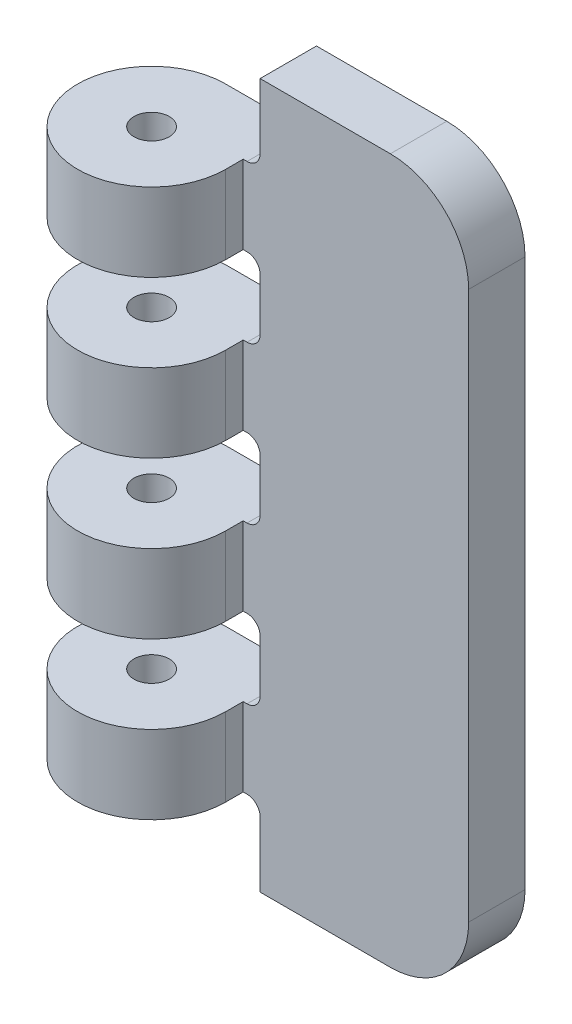
from build123d import *

# Parameters (mm, degrees)
BOSS_EXTRUDE1_START = 31.75
SKETCH3_R           = 1.5875
BOSS_EXTRUDE1_DEPTH = 63.5
FILLET1_R           = 7.055555556
SKETCH5_W           = 16.383
SKETCH5_H           = 7.055555556
CUT_EXTRUDE1_DEPTH  = 43.200038063
LPATTERN1_COUNT     = 5
LPATTERN1_PITCH     = 14.111111111
FILLET2_R           = 1.175925926


with BuildPart() as part:
    # Sketch3 → Boss-Extrude1 (new body)
    with BuildSketch(Plane(origin=(0, 0, 0), x_dir=(1, 0, 0), z_dir=(0, 1, 0)).offset(BOSS_EXTRUDE1_START)):
        with BuildLine():
            Line((26.9875, 6.6675), (26.9875, 1.5875))
            Line((26.9875, 1.5875), (6.6675, 1.5875))
            Line((6.6675, 1.5875), (6.6675, 0))
            ThreePointArc((6.6675, 0), (-4.714634464, -4.714634464), (0, 6.6675))
            Line((0, 6.6675), (26.9875, 6.6675))
        make_face()
        with Locations(Location((0, 0, 0), (0, 0, 270))):
            Circle(SKETCH3_R, mode=Mode.SUBTRACT)
    extrude(amount=-BOSS_EXTRUDE1_DEPTH)

    # Fillet1
    fillet1_edges = [part.edges().sort_by_distance(p)[0] for p in [
        (26.9875, -31.75, -4.1275),
        (26.9875, 31.75, -4.1275),
    ]]
    fillet(fillet1_edges, radius=FILLET1_R)

    # Sketch5 → Cut-Extrude1 (cut, symmetric)
    with BuildSketch(Plane.XY):
        with Locations((0, 28.222222222)):
            Rectangle(SKETCH5_W, SKETCH5_H)
    cut_extrude1 = extrude(amount=CUT_EXTRUDE1_DEPTH, both=True, mode=Mode.SUBTRACT)

    # LPattern1: Cut-Extrude1 ×5
    with Locations(*[(0, -i * LPATTERN1_PITCH, 0) for i in range(1, LPATTERN1_COUNT)]):
        add(cut_extrude1, mode=Mode.SUBTRACT)

    # Fillet2
    fillet2_edges = [part.edges().sort_by_distance(p)[0] for p in [
        (8.1915, -3.527777778, -4.1275),
        (8.1915, 3.527777778, -4.1275),
        (8.1915, -17.638888889, -4.1275),
        (8.1915, -10.583333333, -4.1275),
        (8.1915, -24.694444444, -4.1275),
        (8.1915, 24.694444444, -4.1275),
        (8.1915, 10.583333333, -4.1275),
        (8.1915, 17.638888889, -4.1275),
    ]]
    fillet(fillet2_edges, radius=FILLET2_R)


solid = part.part
